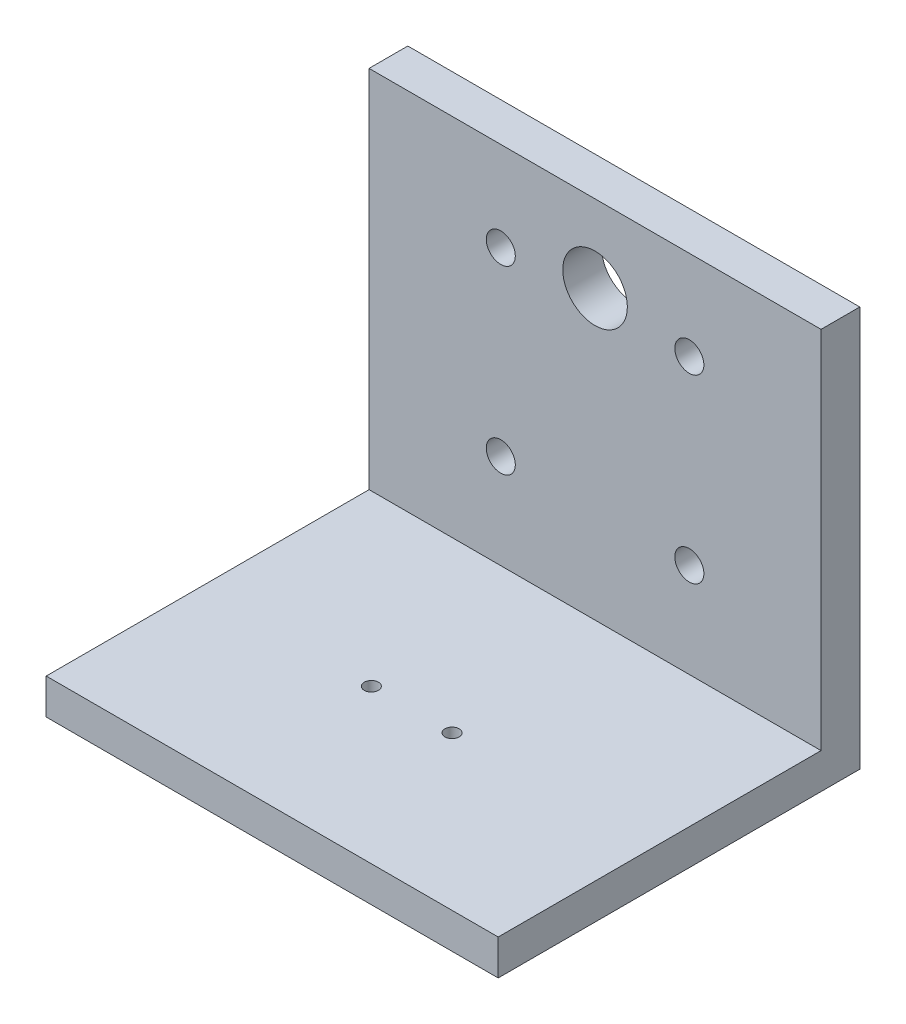
from build123d import *

# Parameters (mm, degrees)
ESQUISSE1_W             = 70
ESQUISSE1_H             = 62
ESQUISSE1_R             = 2.25
BOSS_EXTRU_3_DEPTH      = 6
ESQUISSE3_W             = 70
ESQUISSE3_H             = 5.5
BOSS_EXTRU_4_DEPTH      = 50
ESQUISSE4_R             = 1.1
ENL_V_MAT_EXTRU_1_DEPTH = 88.550819181
ESQUISSE5_R             = 5
ENL_V_MAT_EXTRU_2_DEPTH = 50


with BuildPart() as part:
    # Esquisse1 → Boss.-Extru.3 (new body)
    with BuildSketch(Plane.XY):
        with Locations((1.563587615, -10.397163121)):
            Rectangle(ESQUISSE1_W, ESQUISSE1_H)
        with Locations((-13.036412385, 6.752836879)):
            Circle(ESQUISSE1_R, mode=Mode.SUBTRACT)
        with Locations((16.163587615, 6.752836879)):
            Circle(ESQUISSE1_R, mode=Mode.SUBTRACT)
        with Locations((-13.036412385, -21.247163121)):
            Circle(ESQUISSE1_R, mode=Mode.SUBTRACT)
        with Locations((16.163587615, -21.247163121)):
            Circle(ESQUISSE1_R, mode=Mode.SUBTRACT)
    extrude(amount=BOSS_EXTRU_3_DEPTH)

    # Esquisse3 → Boss.-Extru.4 (add)
    with BuildSketch(Plane.XY.offset(6)):
        with Locations((1.563587615, -38.647163121)):
            Rectangle(ESQUISSE3_W, ESQUISSE3_H)
    extrude(amount=BOSS_EXTRU_4_DEPTH)

    # Esquisse4 → Enlèv. mat.-Extru.1 (cut, through all)
    with BuildSketch(Plane(origin=(0, -35.897163121, 0), x_dir=(1, 0, 0), z_dir=(0, 1, 0))):
        with Locations(Location((-6.886412385, -32.194360359, 0), (0, 0, 270))):
            Circle(ESQUISSE4_R)
        with Locations(Location((5.613587615, -32.194360359, 0), (0, 0, 270))):
            Circle(ESQUISSE4_R)
    extrude(amount=-ENL_V_MAT_EXTRU_1_DEPTH, mode=Mode.SUBTRACT)

    # Esquisse5 → Enlèv. mat.-Extru.2 (cut)
    with BuildSketch(Plane(origin=(0, 0, 0), x_dir=(-1, 0, 0), z_dir=(0, 0, -1))):
        with Locations((-1.563587615, 8.602836879)):
            Circle(ESQUISSE5_R)
    extrude(amount=-ENL_V_MAT_EXTRU_2_DEPTH, mode=Mode.SUBTRACT)


solid = part.part
